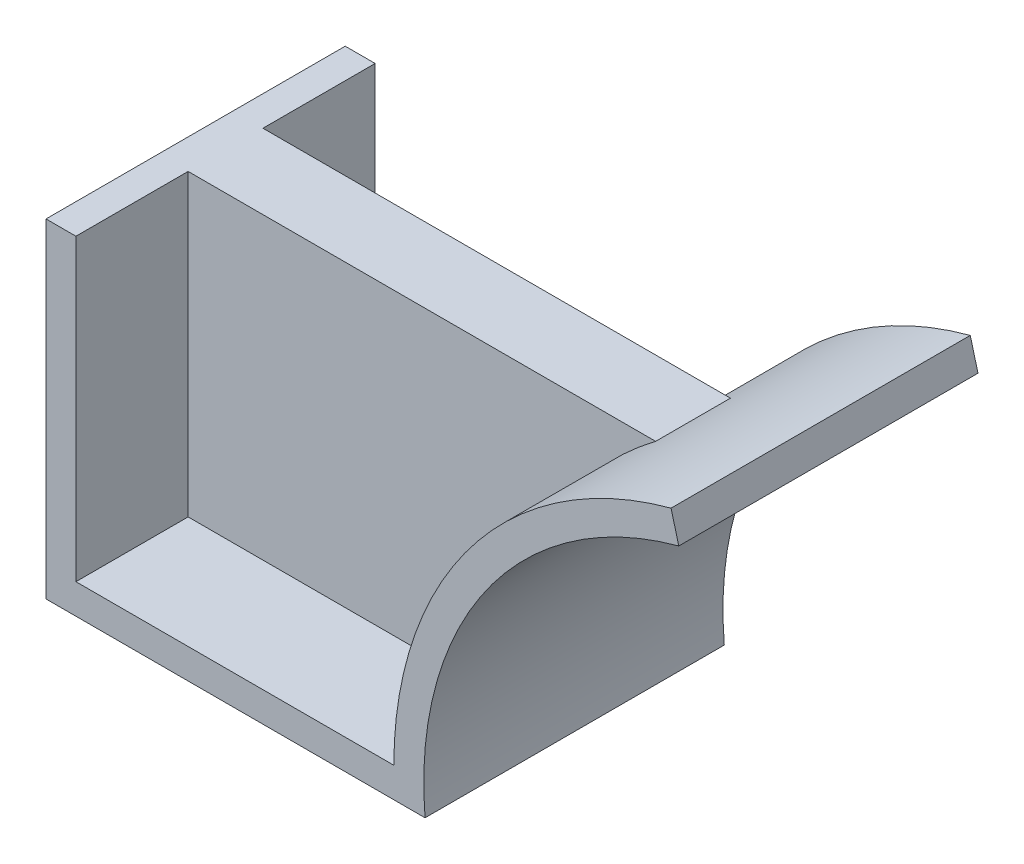
from build123d import *

# Parameters (mm, degrees)
EXTRUDE_THIN1_DEPTH      = 80
BOSS_EXTRUDE1_REACH      = 206.235
BOSS_EXTRUDE1_END_RADIUS = 100
SKETCH2_W                = 20
SKETCH2_H                = 80


with BuildPart() as part:
    # Sketch1 → Extrude-Thin1 (new body)
    with BuildSketch(Plane.XY):
        with BuildLine():
            Line((0, 80), (0, 0))
            Line((0, 0), (85, 0))
            ThreePointArc((85, 0), (105.664665971, 60.876142901), (159.11809549, 96.592582629))
            Line((159.11809549, 96.592582629), (161.188647851, 88.865176019))
            ThreePointArc((161.188647851, 88.865176019), (109.643288684, 52.776567335), (93.348486101, -8))
            Line((93.348486101, -8), (-8, -8))
            Line((-8, -8), (-8, 80))
            Line((-8, 80), (0, 80))
        make_face()
    extrude(amount=EXTRUDE_THIN1_DEPTH)

    # Boss-Extrude1: up to this cylinder (the profile starts outside it)
    boss_extrude1_end = Plane(origin=(185, 0, 40), z_dir=(0, 0, -1)) * Cylinder(BOSS_EXTRUDE1_END_RADIUS, 613.47, mode=Mode.PRIVATE)
    # Sketch2 → Boss-Extrude1 (add, up to the surface)
    with BuildSketch(Plane(origin=(0, 0, 0), x_dir=(0, 0, -1), z_dir=(1, 0, 0)), mode=Mode.PRIVATE) as boss_extrude1_sk1:
        with Locations((-40, 40)):
            Rectangle(SKETCH2_W, SKETCH2_H)
    boss_extrude1_tool1 = extrude(boss_extrude1_sk1.sketch, amount=BOSS_EXTRUDE1_REACH, mode=Mode.PRIVATE) - boss_extrude1_end
    add(boss_extrude1_tool1.solids().sort_by_distance((0, 40, 40))[0])


solid = part.part
